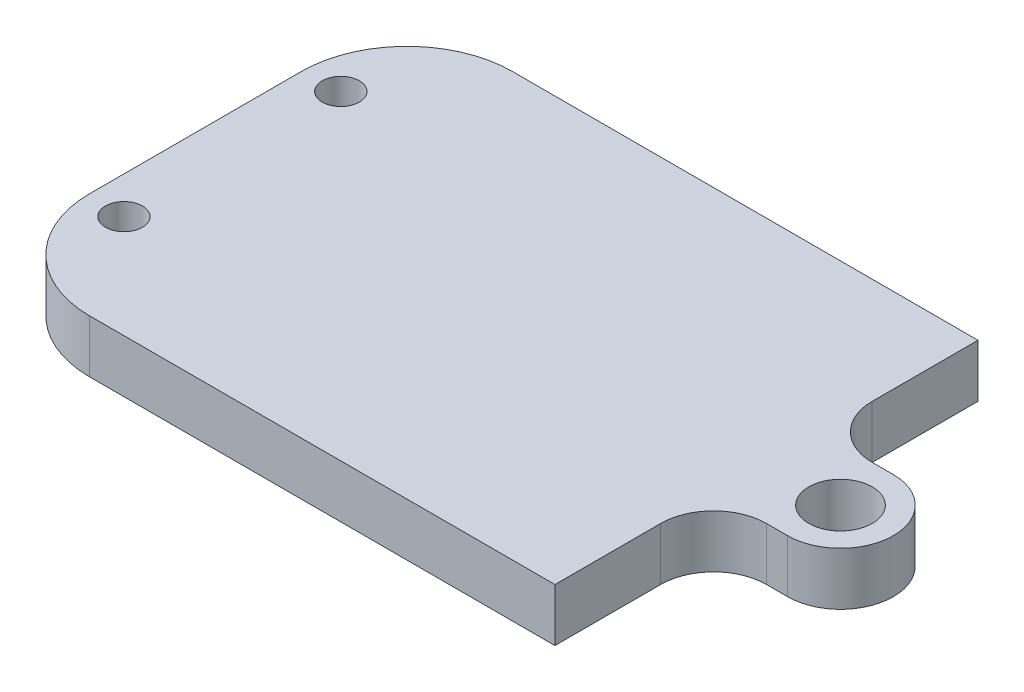
from build123d import *

# Parameters (mm, degrees)
SKETCH1_W           = 53
SKETCH1_H           = 40
BOSS_EXTRUDE1_DEPTH = 5
SKETCH2_R           = 1.75
CUT_EXTRUDE1_DEPTH  = 5
SKETCH3_W           = 40
SKETCH3_H           = 5
BOSS_EXTRUDE2_DEPTH = 1
FILLET2_R           = 10
BOSS_EXTRUDE3_DEPTH = 5
SKETCH5_R           = 3
CUT_EXTRUDE2_DEPTH  = 7
FILLET3_R           = 5


with BuildPart() as part:
    # Sketch1 → Boss-Extrude1 (new body)
    with BuildSketch(Plane(origin=(0, 0, 0), x_dir=(1, 0, 0), z_dir=(0, 1, 0))):
        Rectangle(SKETCH1_W, SKETCH1_H)
    extrude(amount=BOSS_EXTRUDE1_DEPTH)

    # Sketch2 → Cut-Extrude1 (cut)
    with BuildSketch(Plane(origin=(0, 5, 0), x_dir=(1, 0, 0), z_dir=(0, 1, 0))):
        with Locations(Location((-24, 10.252098, 0), (0, 0, 270))):
            Circle(SKETCH2_R)
        with Locations(Location((-24, -10.252098, 0), (0, 0, 270))):
            Circle(SKETCH2_R)
    extrude(amount=-CUT_EXTRUDE1_DEPTH, mode=Mode.SUBTRACT)

    # Sketch3 → Boss-Extrude2 (add)
    with BuildSketch(Plane.ZY.offset(26.5)):
        with Locations((0, 2.5)):
            Rectangle(SKETCH3_W, SKETCH3_H)
    extrude(amount=BOSS_EXTRUDE2_DEPTH)

    # Fillet2
    fillet2_edges = [part.edges().sort_by_distance(p)[0] for p in [
        (-27.5, 2.5, -20),
        (-27.5, 2.5, 20),
    ]]
    fillet(fillet2_edges, radius=FILLET2_R)

    # Sketch4 → Boss-Extrude3 (add)
    with BuildSketch(Plane(origin=(0, 5, 0), x_dir=(1, 0, 0), z_dir=(0, 1, 0))):
        with BuildLine():
            Line((26.5, 5), (33.5, 5))
            ThreePointArc((33.5, 5), (38.5, 0), (33.5, -5))
            Line((33.5, -5), (26.5, -5))
            Line((26.5, -5), (26.5, 5))
        make_face()
    extrude(amount=-BOSS_EXTRUDE3_DEPTH)

    # Sketch5 → Cut-Extrude2 (cut)
    with BuildSketch(Plane(origin=(0, 5, 0), x_dir=(1, 0, 0), z_dir=(0, 1, 0))):
        with Locations(Location((33.5, 0, 0), (0, 0, 270))):
            Circle(SKETCH5_R)
    extrude(amount=-CUT_EXTRUDE2_DEPTH, mode=Mode.SUBTRACT)

    # Fillet3
    fillet3_edges = [part.edges().sort_by_distance(p)[0] for p in [
        (26.5, 2.5, 5),
        (26.5, 2.5, -5),
    ]]
    fillet(fillet3_edges, radius=FILLET3_R)


solid = part.part
